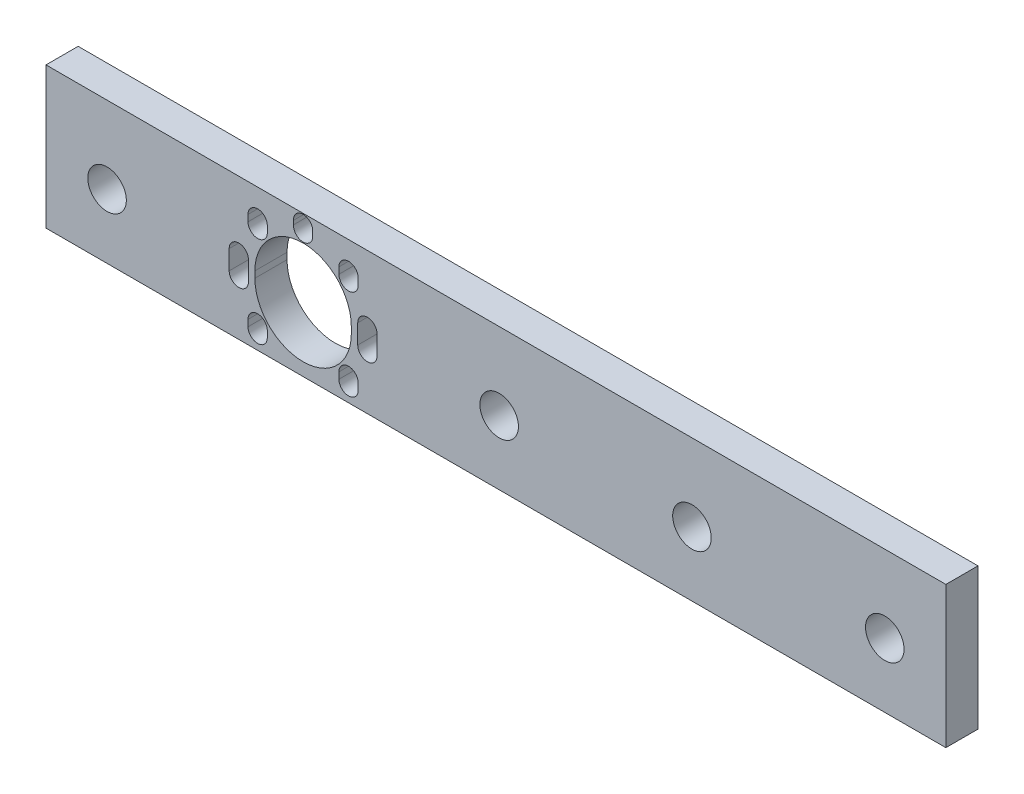
from build123d import *

# Parameters (mm, degrees)
SKETCH_1_R      = 3
EXTRUDE_1_DEPTH = 5


with BuildPart() as part:
    # 스케치1 → 보스-돌출1 (new body)
    with BuildSketch(Plane.XY):
        Polygon((0, 22.1), (0, 10.1), (0, 0.1), (140, 0.1), (140, 10.1), (140, 22.1), align=None)
        with BuildLine():
            Line((31.428932188, 2.528932188), (31.428932188, 3.028932188))
            Line((31.428932188, 3.028932188), (31.428932188, 3.528932188))
            ThreePointArc((31.428932188, 3.528932188), (32.928932188, 5.028932188), (34.428932188, 3.528932188))
            Line((34.428932188, 3.528932188), (34.428932188, 3.028932188))
            Line((34.428932188, 3.028932188), (34.428932188, 2.528932188))
            ThreePointArc((34.428932188, 2.528932188), (32.928932188, 1.028932188), (31.428932188, 2.528932188))
        make_face(mode=Mode.SUBTRACT)
        with BuildLine():
            Line((48.571067812, 3.528932188), (48.571067812, 3.028932188))
            Line((48.571067812, 3.028932188), (48.571067812, 2.528932188))
            ThreePointArc((48.571067812, 2.528932188), (47.071067812, 1.028932188), (45.571067812, 2.528932188))
            Line((45.571067812, 2.528932188), (45.571067812, 3.028932188))
            Line((45.571067812, 3.028932188), (45.571067812, 3.528932188))
            ThreePointArc((45.571067812, 3.528932188), (47.071067812, 5.028932188), (48.571067812, 3.528932188))
        make_face(mode=Mode.SUBTRACT)
        with BuildLine():
            ThreePointArc((12.5, 10.1), (9.5, 7.1), (6.5, 10.1))
            ThreePointArc((6.5, 10.1), (9.5, 13.1), (12.5, 10.1))
        make_face(mode=Mode.SUBTRACT)
        with BuildLine():
            Line((28.5, 8.6), (28.5, 10.1))
            Line((28.5, 10.1), (28.5, 11.6))
            ThreePointArc((28.5, 11.6), (30, 13.1), (31.5, 11.6))
            Line((31.5, 11.6), (31.5, 10.1))
            Line((31.5, 10.1), (31.5, 8.6))
            ThreePointArc((31.5, 8.6), (30, 7.1), (28.5, 8.6))
        make_face(mode=Mode.SUBTRACT)
        with BuildLine():
            Line((32.5, 9.6), (32.5, 10.1))
            Line((32.5, 10.1), (32.5, 10.6))
            ThreePointArc((32.5, 10.6), (34.696699141, 15.903300859), (40, 18.1))
            ThreePointArc((40, 18.1), (45.303300859, 15.903300859), (47.5, 10.6))
            Line((47.5, 10.6), (47.5, 10.1))
            Line((47.5, 10.1), (47.5, 9.6))
            ThreePointArc((47.5, 9.6), (40, 2.1), (32.5, 9.6))
        make_face(mode=Mode.SUBTRACT)
        with BuildLine():
            Line((51.5, 11.6), (51.5, 10.1))
            Line((51.5, 10.1), (51.5, 8.6))
            ThreePointArc((51.5, 8.6), (50, 7.1), (48.5, 8.6))
            Line((48.5, 8.6), (48.5, 10.1))
            Line((48.5, 10.1), (48.5, 11.6))
            ThreePointArc((48.5, 11.6), (50, 13.1), (51.5, 11.6))
        make_face(mode=Mode.SUBTRACT)
        with Locations((70.5, 10.1)):
            Circle(SKETCH_1_R, mode=Mode.SUBTRACT)
        with Locations((100.5, 10.1)):
            Circle(SKETCH_1_R, mode=Mode.SUBTRACT)
        with Locations((130.5, 10.1)):
            Circle(SKETCH_1_R, mode=Mode.SUBTRACT)
        with BuildLine():
            Line((31.428932188, 16.671067812), (31.428932188, 17.171067812))
            Line((31.428932188, 17.171067812), (31.428932188, 17.671067812))
            ThreePointArc((31.428932188, 17.671067812), (32.928932188, 19.171067812), (34.428932188, 17.671067812))
            Line((34.428932188, 17.671067812), (34.428932188, 17.171067812))
            Line((34.428932188, 17.171067812), (34.428932188, 16.671067812))
            ThreePointArc((34.428932188, 16.671067812), (32.928932188, 15.171067812), (31.428932188, 16.671067812))
        make_face(mode=Mode.SUBTRACT)
        with BuildLine():
            Line((45.571067812, 16.671067812), (45.571067812, 17.171067812))
            Line((45.571067812, 17.171067812), (45.571067812, 17.671067812))
            ThreePointArc((45.571067812, 17.671067812), (47.071067812, 19.171067812), (48.571067812, 17.671067812))
            Line((48.571067812, 17.671067812), (48.571067812, 17.171067812))
            Line((48.571067812, 17.171067812), (48.571067812, 16.671067812))
            ThreePointArc((48.571067812, 16.671067812), (47.071067812, 15.171067812), (45.571067812, 16.671067812))
        make_face(mode=Mode.SUBTRACT)
        with BuildLine():
            Line((38.5, 19.8), (38.5, 20.1))
            Line((38.5, 20.1), (38.5, 20.4))
            ThreePointArc((38.5, 20.4), (40, 21.967353054), (41.5, 20.4))
            Line((41.5, 20.4), (41.5, 20.1))
            Line((41.5, 20.1), (41.5, 19.8))
            ThreePointArc((41.5, 19.8), (40, 18.232646946), (38.5, 19.8))
        make_face(mode=Mode.SUBTRACT)
    extrude(amount=EXTRUDE_1_DEPTH)


solid = part.part
